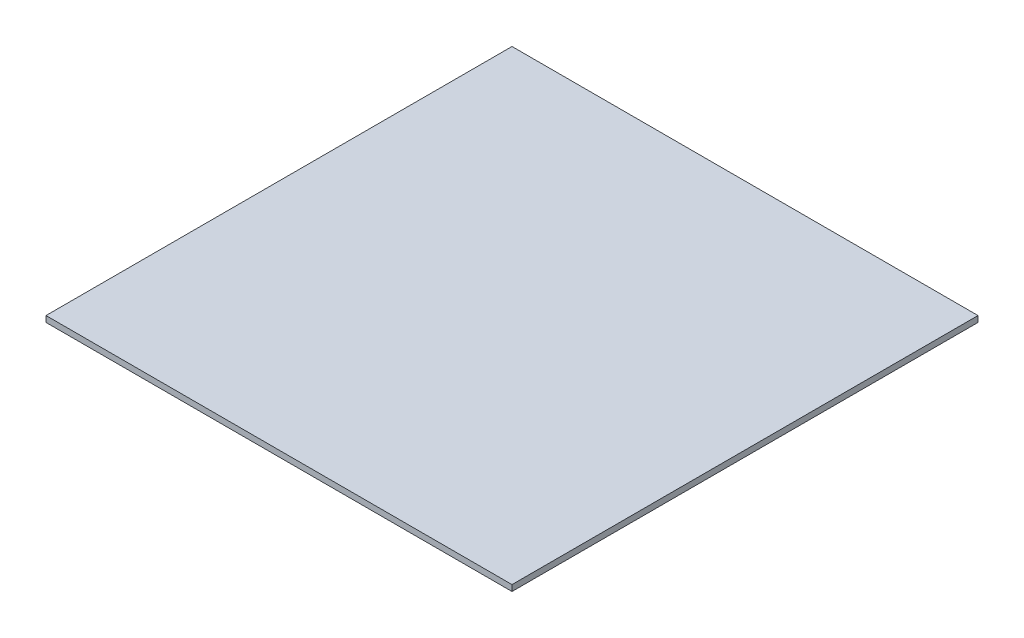
from build123d import *

# Parameters (mm, degrees)
SKETCH1_W           = 310
SKETCH1_H           = 310
BOSS_EXTRUDE1_DEPTH = 4


with BuildPart() as part:
    # Sketch1 → Boss-Extrude1 (new body)
    with BuildSketch(Plane(origin=(0, 0, 0), x_dir=(1, 0, 0), z_dir=(0, 1, 0))):
        Rectangle(SKETCH1_W, SKETCH1_H)
    extrude(amount=BOSS_EXTRUDE1_DEPTH)


solid = part.part
